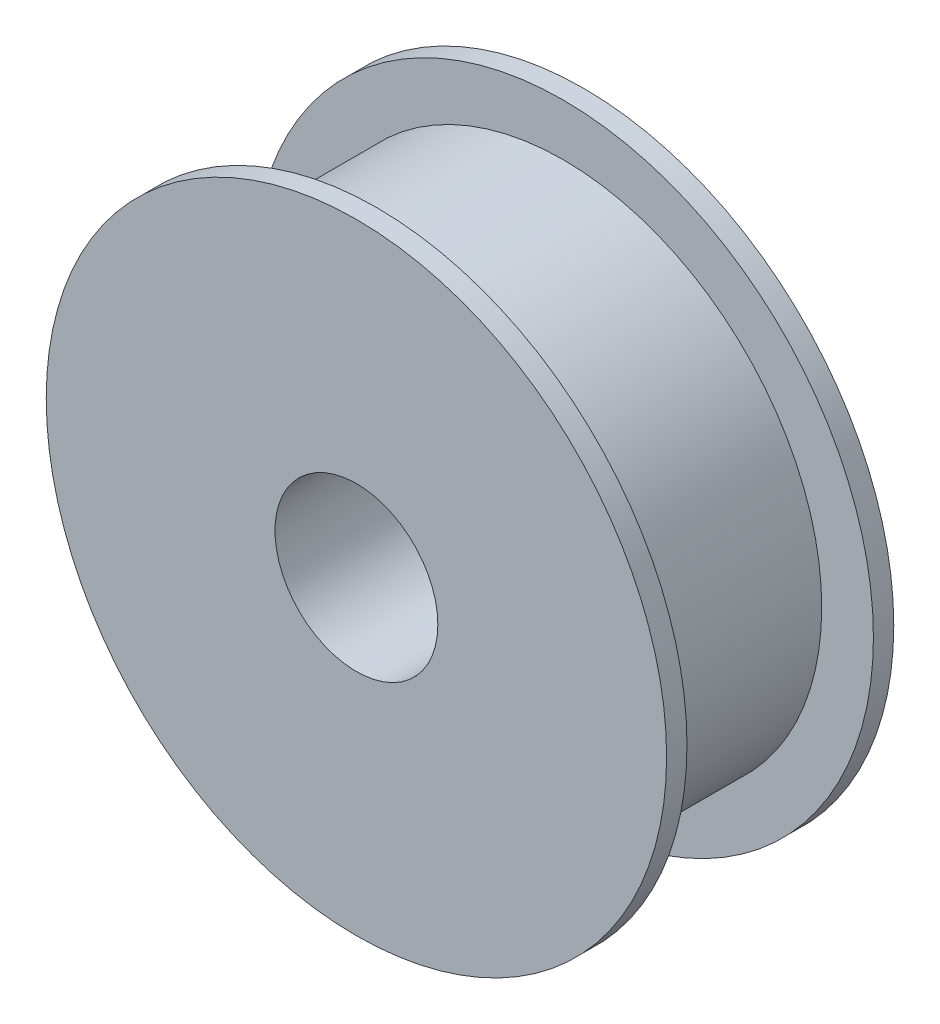
from build123d import *

# Parameters (mm, degrees)
SKETCH1_R           = 63.5
SKETCH1_R_2         = 20
BOSS_EXTRUDE1_DEPTH = 50.8
SKETCH3_R           = 76.2
SKETCH3_R_2         = 5.1
SKETCH3_R_3         = 1.5
BOSS_EXTRUDE2_DEPTH = 5
SKETCH4_R           = 76.2
SKETCH4_R_2         = 20
BOSS_EXTRUDE3_DEPTH = 5
SKETCH5_R           = 11.1
CUT_EXTRUDE1_DEPTH  = 1.2
SKETCH6_R           = 1.5875
BOSS_EXTRUDE4_DEPTH = 2.5


with BuildPart() as part:
    # Sketch1 → Boss-Extrude1 (new body)
    with BuildSketch(Plane.XY):
        Circle(SKETCH1_R)
        Circle(SKETCH1_R_2, mode=Mode.SUBTRACT)
    extrude(amount=BOSS_EXTRUDE1_DEPTH)

    # Sketch3 → Boss-Extrude2 (add)
    with BuildSketch(Plane.XY):
        Circle(SKETCH3_R)
        Circle(SKETCH3_R_2, mode=Mode.SUBTRACT)
        with Locations((0, 8)):
            Circle(SKETCH3_R_3, mode=Mode.SUBTRACT)
        with Locations((8, 0)):
            Circle(SKETCH3_R_3, mode=Mode.SUBTRACT)
        with Locations((0, -8)):
            Circle(SKETCH3_R_3, mode=Mode.SUBTRACT)
        with Locations((-8, 0)):
            Circle(SKETCH3_R_3, mode=Mode.SUBTRACT)
    extrude(amount=BOSS_EXTRUDE2_DEPTH)

    # Sketch4 → Boss-Extrude3 (add)
    with BuildSketch(Plane.XY.offset(50.8)):
        Circle(SKETCH4_R)
        Circle(SKETCH4_R_2, mode=Mode.SUBTRACT)
    extrude(amount=BOSS_EXTRUDE3_DEPTH)

    # Sketch5 → Cut-Extrude1 (cut)
    with BuildSketch(Plane(origin=(0, 0, 0), x_dir=(-1, 0, 0), z_dir=(0, 0, -1))):
        Circle(SKETCH5_R)
    extrude(amount=-CUT_EXTRUDE1_DEPTH, mode=Mode.SUBTRACT)

    # Sketch6 → Boss-Extrude4 (add, symmetric)
    with BuildSketch(Plane(origin=(0, 0, 0), x_dir=(1, 0, 0), z_dir=(0, 1, 0))):
        with BuildLine():
            Line((-59.663256535, -29.884375), (-59.663256535, -24.328125))
            Line((-59.663256535, -24.328125), (-67.336743465, -24.328125))
            ThreePointArc((-67.336743465, -24.328125), (-70.114868465, -27.10625), (-67.336743465, -29.884375))
            Line((-67.336743465, -29.884375), (-59.663256535, -29.884375))
        make_face()
        with Locations(Location((-67.336743465, -27.10625, 0), (0, 0, 270))):
            Circle(SKETCH6_R, mode=Mode.SUBTRACT)
    extrude(amount=BOSS_EXTRUDE4_DEPTH, both=True)


solid = part.part
